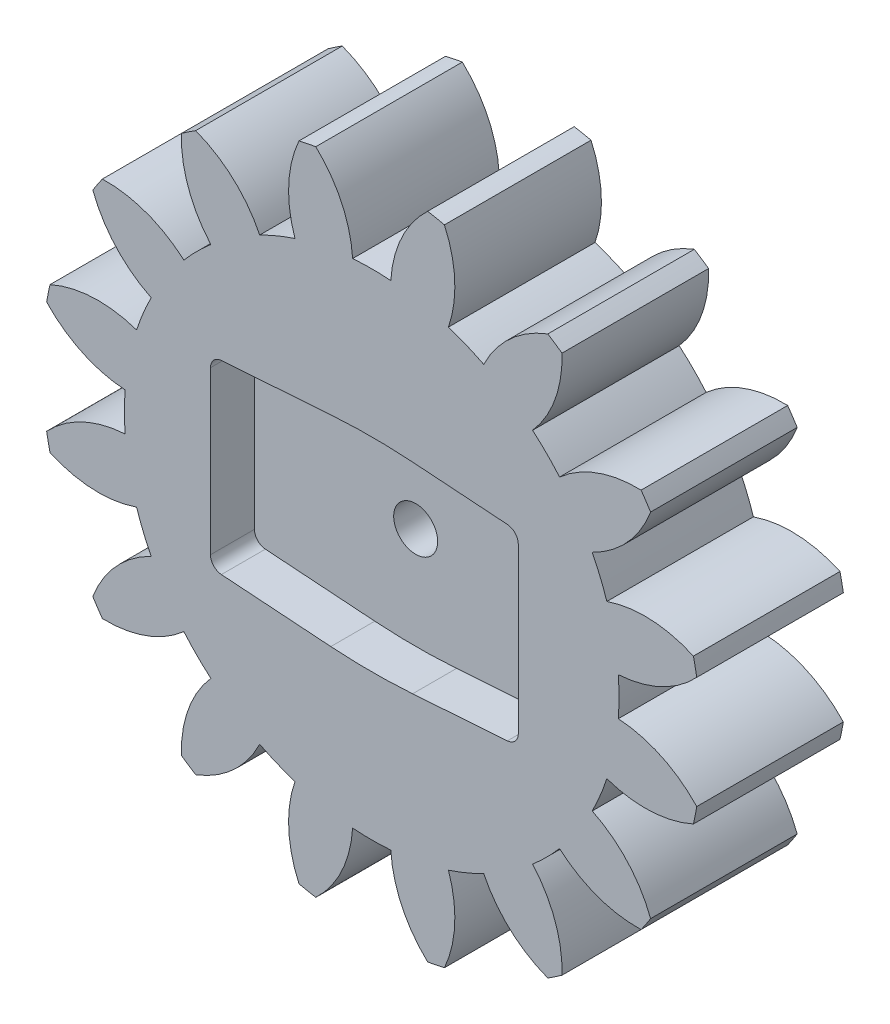
from build123d import *

# Parameters (mm, degrees)
SALIENTE_EXTRUIR1_DEPTH = 5
CORTAR_EXTRUIR1_REACH   = 18.457
CROQUIS4_R              = 0.75
CORTAR_EXTRUIR2_START   = -3.5
CROQUIS4_3_R            = 1.5
CROQUIS4_3_R_2          = 0.75
CORTAR_EXTRUIR2_DEPTH   = 1.5
CROQUIS4_4_R            = 1.5
CROQUIS4_4_R_2          = 0.75
CORTAR_EXTRUIR3_DEPTH   = 1.5
REDONDEO2_R             = 0.4


with BuildPart() as part:
    # Croquis2 → Saliente-Extruir1 (new body)
    with BuildSketch(Plane.XY):
        with BuildLine():
            ThreePointArc((8.411340626, 0.651061533), (9.869549365, 1.023063112), (11.087096586, 1.907561087))
            ThreePointArc((11.087096586, 1.907561087), (11.033834405, 2.194766123), (10.973133635, 2.480491531))
            ThreePointArc((10.973133635, 2.480491531), (9.509783957, 2.831725957), (8.020215908, 2.617378277))
            ThreePointArc((8.020215908, 2.617378277), (7.794309676, 3.228508777), (7.521914983, 3.820383127))
            ThreePointArc((7.521914983, 3.820383127), (8.72676535, 4.722100097), (9.513149586, 6.005204821))
            ThreePointArc((9.513149586, 6.005204821), (9.354033138, 6.250165121), (9.188610559, 6.4909118))
            ThreePointArc((9.188610559, 6.4909118), (7.702240148, 6.255410419), (6.408086021, 5.487345971))
            ThreePointArc((6.408086021, 5.487345971), (5.965506359, 5.965506359), (5.487345971, 6.408086021))
            ThreePointArc((5.487345971, 6.408086021), (6.255410419, 7.702240148), (6.4909118, 9.188610559))
            ThreePointArc((6.4909118, 9.188610559), (6.250165121, 9.354033138), (6.005204821, 9.513149586))
            ThreePointArc((6.005204821, 9.513149586), (4.722100097, 8.72676535), (3.820383127, 7.521914983))
            ThreePointArc((3.820383127, 7.521914983), (3.228508777, 7.794309676), (2.617378277, 8.020215908))
            ThreePointArc((2.617378277, 8.020215908), (2.831725957, 9.509783957), (2.480491531, 10.973133635))
            ThreePointArc((2.480491531, 10.973133635), (2.194766123, 11.033834405), (1.907561087, 11.087096586))
            ThreePointArc((1.907561087, 11.087096586), (1.023063112, 9.869549365), (0.651061533, 8.411340626))
            ThreePointArc((0.651061533, 8.411340626), (0, 8.4365), (-0.651061533, 8.411340626))
            ThreePointArc((-0.651061533, 8.411340626), (-1.023063112, 9.869549365), (-1.907561087, 11.087096586))
            ThreePointArc((-1.907561087, 11.087096586), (-2.194766123, 11.033834405), (-2.480491531, 10.973133635))
            ThreePointArc((-2.480491531, 10.973133635), (-2.831725957, 9.509783957), (-2.617378277, 8.020215908))
            ThreePointArc((-2.617378277, 8.020215908), (-3.228508777, 7.794309676), (-3.820383127, 7.521914983))
            ThreePointArc((-3.820383127, 7.521914983), (-4.722100097, 8.72676535), (-6.005204821, 9.513149586))
            ThreePointArc((-6.005204821, 9.513149586), (-6.250165121, 9.354033138), (-6.4909118, 9.188610559))
            ThreePointArc((-6.4909118, 9.188610559), (-6.255410419, 7.702240148), (-5.487345971, 6.408086021))
            ThreePointArc((-5.487345971, 6.408086021), (-5.965506359, 5.965506359), (-6.408086021, 5.487345971))
            ThreePointArc((-6.408086021, 5.487345971), (-7.702240148, 6.255410419), (-9.188610559, 6.4909118))
            ThreePointArc((-9.188610559, 6.4909118), (-9.354033138, 6.250165121), (-9.513149586, 6.005204821))
            ThreePointArc((-9.513149586, 6.005204821), (-8.72676535, 4.722100097), (-7.521914983, 3.820383127))
            ThreePointArc((-7.521914983, 3.820383127), (-7.794309676, 3.228508777), (-8.020215908, 2.617378277))
            ThreePointArc((-8.020215908, 2.617378277), (-9.509783957, 2.831725957), (-10.973133635, 2.480491531))
            ThreePointArc((-10.973133635, 2.480491531), (-11.033834405, 2.194766123), (-11.087096586, 1.907561087))
            ThreePointArc((-11.087096586, 1.907561087), (-9.869549365, 1.023063112), (-8.411340626, 0.651061533))
            ThreePointArc((-8.411340626, 0.651061533), (-8.4365, 0), (-8.411340626, -0.651061533))
            ThreePointArc((-8.411340626, -0.651061533), (-9.869549365, -1.023063112), (-11.087096586, -1.907561087))
            ThreePointArc((-11.087096586, -1.907561087), (-11.033834405, -2.194766123), (-10.973133635, -2.480491531))
            ThreePointArc((-10.973133635, -2.480491531), (-9.509783957, -2.831725957), (-8.020215908, -2.617378277))
            ThreePointArc((-8.020215908, -2.617378277), (-7.794309676, -3.228508777), (-7.521914983, -3.820383127))
            ThreePointArc((-7.521914983, -3.820383127), (-8.72676535, -4.722100097), (-9.513149586, -6.005204821))
            ThreePointArc((-9.513149586, -6.005204821), (-9.354033138, -6.250165121), (-9.188610559, -6.4909118))
            ThreePointArc((-9.188610559, -6.4909118), (-7.702240148, -6.255410419), (-6.408086021, -5.487345971))
            ThreePointArc((-6.408086021, -5.487345971), (-5.965506359, -5.965506359), (-5.487345971, -6.408086021))
            ThreePointArc((-5.487345971, -6.408086021), (-6.255410419, -7.702240148), (-6.4909118, -9.188610559))
            ThreePointArc((-6.4909118, -9.188610559), (-6.250165121, -9.354033138), (-6.005204821, -9.513149586))
            ThreePointArc((-6.005204821, -9.513149586), (-4.722100097, -8.72676535), (-3.820383127, -7.521914983))
            ThreePointArc((-3.820383127, -7.521914983), (-3.228508777, -7.794309676), (-2.617378277, -8.020215908))
            ThreePointArc((-2.617378277, -8.020215908), (-2.831725957, -9.509783957), (-2.480491531, -10.973133635))
            ThreePointArc((-2.480491531, -10.973133635), (-2.194766123, -11.033834405), (-1.907561087, -11.087096586))
            ThreePointArc((-1.907561087, -11.087096586), (-1.023063112, -9.869549365), (-0.651061533, -8.411340626))
            ThreePointArc((-0.651061533, -8.411340626), (0, -8.4365), (0.651061533, -8.411340626))
            ThreePointArc((0.651061533, -8.411340626), (1.023063112, -9.869549365), (1.907561087, -11.087096586))
            ThreePointArc((1.907561087, -11.087096586), (2.194766123, -11.033834405), (2.480491531, -10.973133635))
            ThreePointArc((2.480491531, -10.973133635), (2.831725957, -9.509783957), (2.617378277, -8.020215908))
            ThreePointArc((2.617378277, -8.020215908), (3.228508777, -7.794309676), (3.820383127, -7.521914983))
            ThreePointArc((3.820383127, -7.521914983), (4.722100097, -8.72676535), (6.005204821, -9.513149586))
            ThreePointArc((6.005204821, -9.513149586), (6.250165121, -9.354033138), (6.4909118, -9.188610559))
            ThreePointArc((6.4909118, -9.188610559), (6.255410419, -7.702240148), (5.487345971, -6.408086021))
            ThreePointArc((5.487345971, -6.408086021), (5.965506359, -5.965506359), (6.408086021, -5.487345971))
            ThreePointArc((6.408086021, -5.487345971), (7.702240148, -6.255410419), (9.188610559, -6.4909118))
            ThreePointArc((9.188610559, -6.4909118), (9.354033138, -6.250165121), (9.513149586, -6.005204821))
            ThreePointArc((9.513149586, -6.005204821), (8.72676535, -4.722100097), (7.521914983, -3.820383127))
            ThreePointArc((7.521914983, -3.820383127), (7.794309676, -3.228508777), (8.020215908, -2.617378277))
            ThreePointArc((8.020215908, -2.617378277), (9.509783957, -2.831725957), (10.973133635, -2.480491531))
            ThreePointArc((10.973133635, -2.480491531), (11.033834405, -2.194766123), (11.087096586, -1.907561087))
            ThreePointArc((11.087096586, -1.907561087), (9.869549365, -1.023063112), (8.411340626, -0.651061533))
            ThreePointArc((8.411340626, -0.651061533), (8.4365, 0), (8.411340626, 0.651061533))
        make_face()
    extrude(amount=SALIENTE_EXTRUIR1_DEPTH)

    # Croquis4 → Cortar-Extruir1 (cut, up to next)
    with BuildSketch(Plane.XY.offset(5), mode=Mode.PRIVATE) as cortar_extruir1_sk1:
        Circle(CROQUIS4_R)
    cortar_extruir1_tool1 = extrude(cortar_extruir1_sk1.sketch, amount=-CORTAR_EXTRUIR1_REACH, mode=Mode.PRIVATE) & part.part
    add(cortar_extruir1_tool1.solids().sort_by_distance((0, 0, 5))[0], mode=Mode.SUBTRACT)

    # Croquis4<3> → Cortar-Extruir2 (cut)
    with BuildSketch(Plane.XY.offset(5).offset(CORTAR_EXTRUIR2_START)):
        Circle(CROQUIS4_3_R)
        Circle(CROQUIS4_3_R_2, mode=Mode.SUBTRACT)
    extrude(amount=-CORTAR_EXTRUIR2_DEPTH, mode=Mode.SUBTRACT)

    # Croquis4<4> → Cortar-Extruir3 (cut)
    # profile 1 of 2: a face of its own
    with BuildSketch(Plane.XY.offset(5)):
        with BuildLine():
            Line((-5.5, 3.135446053), (-5.5, -3.135446053))
            Line((-5.5, -3.135446053), (-1.395129475, -3.422486562))
            ThreePointArc((-1.395129475, -3.422486562), (0, -3.471205557), (1.395129475, -3.422486562))
            Line((1.395129475, -3.422486562), (5, -3.170409459))
            Line((5, -3.170409459), (5, 3.170409459))
            Line((5, 3.170409459), (1.395129475, 3.422486562))
            ThreePointArc((1.395129475, 3.422486562), (0, 3.471205557), (-1.395129475, 3.422486562))
            Line((-1.395129475, 3.422486562), (-5.5, 3.135446053))
        make_face()
        Circle(CROQUIS4_4_R, mode=Mode.SUBTRACT)
    # profile 2 of 2: a face of its own
    with BuildSketch(Plane.XY.offset(5)):
        Circle(CROQUIS4_4_R)
        Circle(CROQUIS4_4_R_2, mode=Mode.SUBTRACT)
    extrude(amount=-CORTAR_EXTRUIR3_DEPTH, mode=Mode.SUBTRACT)

    # Redondeo2
    redondeo2_edges = [part.edges().sort_by_distance(p)[0] for p in [
        (5, 3.170409459, 4.25),
        (5, -3.170409459, 4.25),
        (-5.5, -3.135446053, 4.25),
        (-5.5, 3.135446053, 4.25),
    ]]
    fillet(redondeo2_edges, radius=REDONDEO2_R)


solid = part.part
